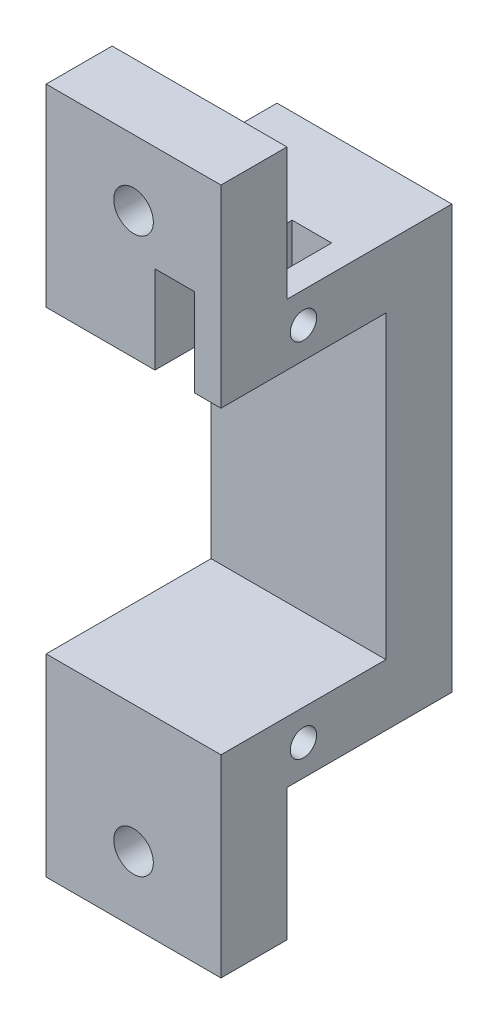
from build123d import *

# Parameters (mm, degrees)
ESBO_O1_W                = 13.25
ESBO_O1_H                = 12.5
RESSALTO_EXTRUS_O1_DEPTH = 4.65
ESBO_O2_W                = 13.25
ESBO_O2_H                = 32.05
RESSALTO_EXTRUS_O2_DEPTH = 5
ESBO_O3_W                = 13.25
ESBO_O3_H                = 4.65
RESSALTO_EXTRUS_O3_DEPTH = 12.5
ESBO_O4_W                = 13.25
ESBO_O4_H                = 5
RESSALTO_EXTRUS_O4_DEPTH = 10
ESBO_O5_W                = 13.25
ESBO_O5_H                = 5
RESSALTO_EXTRUS_O5_DEPTH = 10
ESBO_O6_R                = 1.5
CORTE_EXTRUS_O1_DEPTH    = 10
ESBO_O7_R                = 1
CORTE_EXTRUS_O2_DEPTH    = 48.87512604
ESBO_O8_R                = 1
CORTE_EXTRUS_O3_DEPTH    = 48.87512604
ESBO_O9_W                = 3
ESBO_O9_H                = 10.390977072
CORTE_EXTRUS_O4_DEPTH    = 10
ESBO_O10_W               = 3
ESBO_O10_H               = 2
CORTE_EXTRUS_O5_DEPTH    = 10


with BuildPart() as part:
    # Esboço1 → Ressalto-extrusão1 (new body)
    with BuildSketch(Plane(origin=(0, 0, 0), x_dir=(1, 0, 0), z_dir=(0, 1, 0))):
        with Locations((-15.112918198, -12.411797698)):
            Rectangle(ESBO_O1_W, ESBO_O1_H)
    extrude(amount=-RESSALTO_EXTRUS_O1_DEPTH)

    # Esboço2 → Ressalto-extrusão2 (add)
    with BuildSketch(Plane(origin=(0, 0, 6.161797698), x_dir=(-1, 0, 0), z_dir=(0, 0, -1))):
        with Locations((15.112918198, -16.025)):
            Rectangle(ESBO_O2_W, ESBO_O2_H)
    extrude(amount=RESSALTO_EXTRUS_O2_DEPTH)

    # Esboço3 → Ressalto-extrusão3 (add)
    with BuildSketch(Plane.XY.offset(6.161797698)):
        with Locations((-15.112918198, -29.725)):
            Rectangle(ESBO_O3_W, ESBO_O3_H)
    extrude(amount=RESSALTO_EXTRUS_O3_DEPTH)

    # Esboço4 → Ressalto-extrusão4 (add)
    with BuildSketch(Plane(origin=(0, -32.05, 0), x_dir=(-1, 0, 0), z_dir=(0, -1, 0))):
        with Locations((15.112918198, -16.161797698)):
            Rectangle(ESBO_O4_W, ESBO_O4_H)
    extrude(amount=RESSALTO_EXTRUS_O4_DEPTH)

    # Esboço5 → Ressalto-extrusão5 (add)
    with BuildSketch(Plane(origin=(0, 0, 0), x_dir=(1, 0, 0), z_dir=(0, 1, 0))):
        with Locations((-15.112918198, -16.161797698)):
            Rectangle(ESBO_O5_W, ESBO_O5_H)
    extrude(amount=RESSALTO_EXTRUS_O5_DEPTH)

    # Esboço6 → Corte-extrusão1 (cut)
    with BuildSketch(Plane(origin=(0, 0, 13.661797698), x_dir=(-1, 0, 0), z_dir=(0, 0, -1))):
        with Locations((15.112918198, 5)):
            Circle(ESBO_O6_R)
        with Locations((15.112918198, -37.05)):
            Circle(ESBO_O6_R)
    extrude(amount=-CORTE_EXTRUS_O1_DEPTH, mode=Mode.SUBTRACT)

    # Esboço7 → Corte-extrusão2 (cut, through all)
    with BuildSketch(Plane(origin=(-8.487918198, 0, 0), x_dir=(0, 0, -1), z_dir=(1, 0, 0))):
        with Locations((-12.411797698, -2.325)):
            Circle(ESBO_O7_R)
    extrude(amount=-CORTE_EXTRUS_O2_DEPTH, mode=Mode.SUBTRACT)

    # Esboço8 → Corte-extrusão3 (cut, through all)
    with BuildSketch(Plane(origin=(-8.487918198, 0, 0), x_dir=(0, 0, -1), z_dir=(1, 0, 0))):
        with Locations((-12.411797698, -29.725)):
            Circle(ESBO_O8_R)
    extrude(amount=-CORTE_EXTRUS_O3_DEPTH, mode=Mode.SUBTRACT)

    # Esboço9 → Corte-extrusão4 (cut)
    with BuildSketch(Plane(origin=(0, 0, 0), x_dir=(1, 0, 0), z_dir=(0, 1, 0))):
        with Locations((-11.987918198, -13.466309162)):
            Rectangle(ESBO_O9_W, ESBO_O9_H)
    extrude(amount=-CORTE_EXTRUS_O4_DEPTH, mode=Mode.SUBTRACT)

    # Esboço10 → Corte-extrusão5 (cut)
    with BuildSketch(Plane(origin=(0, 0, 13.661797698), x_dir=(-1, 0, 0), z_dir=(0, 0, -1))):
        with Locations((11.987918198, 1)):
            Rectangle(ESBO_O10_W, ESBO_O10_H)
    extrude(amount=-CORTE_EXTRUS_O5_DEPTH, mode=Mode.SUBTRACT)


solid = part.part
